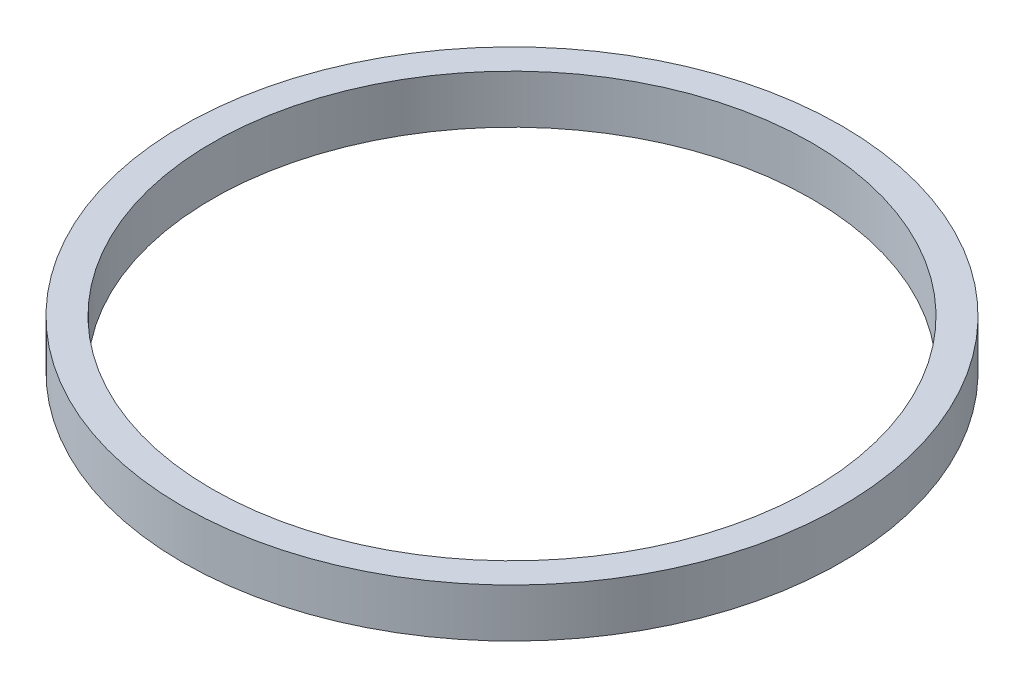
from build123d import *

# Parameters (mm, degrees)
IZIM1_R                     = 18.87
Y_KSEKLIK_EKSTR_ZYON1_DEPTH = 2.78
KES_EKSTR_ZYON1_DEPTH       = 4
KES_EKSTR_ZYON1_DEPTH_BACK  = 5.78
IZIM2_R                     = 17.17


with BuildPart() as part:
    # Çizim1 → Yükseklik-Ekstrüzyon1 (new body)
    with BuildSketch(Plane(origin=(0, 0, 0), x_dir=(1, 0, 0), z_dir=(0, 1, 0))):
        with Locations(Location((0, 0, 0), (0, 0, 270))):
            Circle(IZIM1_R)
    extrude(amount=Y_KSEKLIK_EKSTR_ZYON1_DEPTH)

    # Çizim2 → Kes-Ekstrüzyon1 (cut, two sides: drawn at the far end of the back side and taken through both)
    with BuildSketch(Plane(origin=(0, 2.78, 0), x_dir=(1, 0, 0), z_dir=(0, 1, 0)).offset(-KES_EKSTR_ZYON1_DEPTH_BACK)):
        with Locations(Location((0, 0, 0), (0, 0, 270))):
            Circle(IZIM2_R)
    extrude(amount=KES_EKSTR_ZYON1_DEPTH + KES_EKSTR_ZYON1_DEPTH_BACK, mode=Mode.SUBTRACT)


solid = part.part
